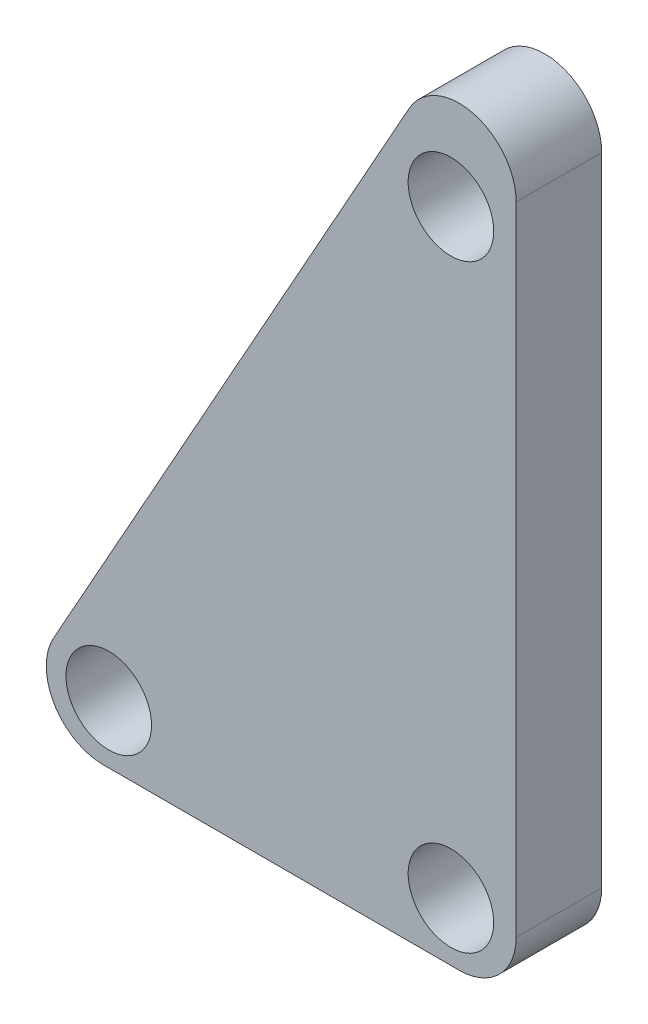
from build123d import *

# Parameters (mm, degrees)
SKETCH1_R           = 15
BOSS_EXTRUDE1_DEPTH = 30


with BuildPart() as part:
    # Sketch1 → Boss-Extrude1 (new body)
    with BuildSketch(Plane.XY):
        with BuildLine():
            Line((-20, 0), (-144.783340837, 0))
            ThreePointArc((-144.783340837, 0), (-162.03295177, 9.87819568), (-162.243059482, 29.754907731))
            Line((-162.243059482, 29.754907731), (-37.459718645, 253.097053316))
            ThreePointArc((-37.459718645, 253.097053316), (-14.95987961, 262.69665892), (0, 243.342145585))
            Line((0, 243.342145585), (0, 20))
            ThreePointArc((0, 20), (-5.857864376, 5.857864376), (-20, 0))
        make_face()
        with Locations((-22.878888765, 230.46347256)):
            Circle(SKETCH1_R, mode=Mode.SUBTRACT)
        with Locations((-22.878888765, 20.46347256)):
            Circle(SKETCH1_R, mode=Mode.SUBTRACT)
        with Locations((-142.878888765, 20.46347256)):
            Circle(SKETCH1_R, mode=Mode.SUBTRACT)
    extrude(amount=BOSS_EXTRUDE1_DEPTH)


solid = part.part
